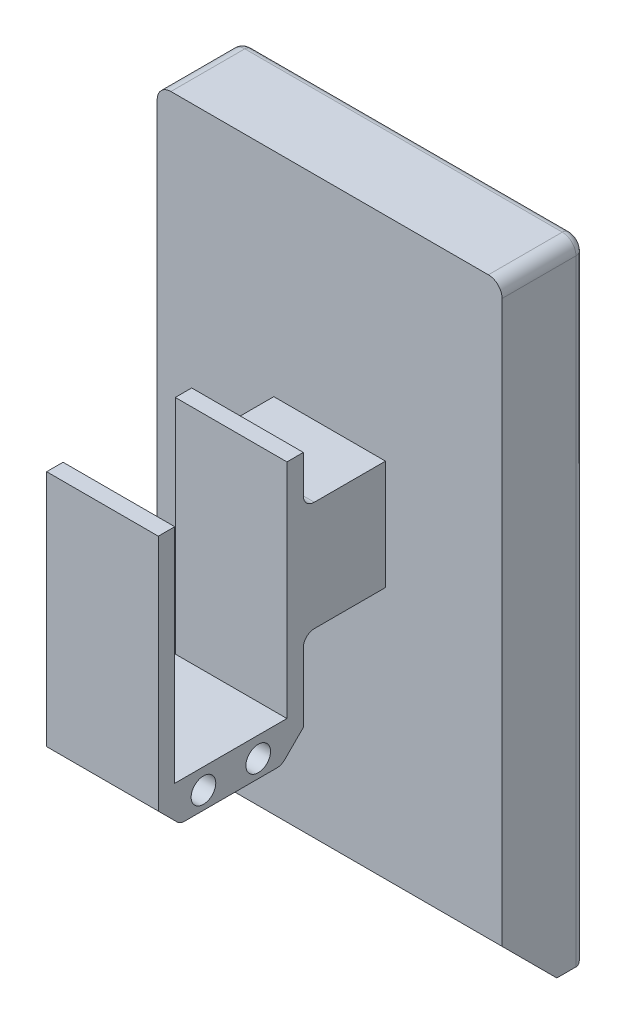
from build123d import *

# Parameters (mm, degrees)
SKETCH1_R            = 2.25
BOSS_EXTRUDE1_DEPTH  = 20
SKETCH2_R            = 2.25
BOSS_EXTRUDE2_DEPTH  = 10
SKETCH4_W            = 26.5
SKETCH4_H            = 2.5
CUT_EXTRUDE1_DEPTH   = 39.17921555
CHAMFER2_SIZE        = 4
CHAMFER3_SIZE        = 4
FILLET4_R            = 2
SKETCH7_W            = 15
SKETCH7_H            = 20
BOSS_EXTRUDE5_DEPTH  = 20
FILLET6_R            = 2
SKETCH13_R           = 2.25
BOSS_EXTRUDE8_DEPTH  = 20
CUT_EXTRUDE2_DEPTH   = 45.021614009
BOSS_EXTRUDE9_START  = -10
SKETCH14_R           = 2.25
BOSS_EXTRUDE9_DEPTH  = 10
BOSS_EXTRUDE10_START = 0.4
SKETCH15_R           = 2.25
BOSS_EXTRUDE10_DEPTH = 0.4
SKETCH16_W           = 63
SKETCH16_H           = 115
BOSS_EXTRUDE11_DEPTH = 15
CHAMFER4_SIZE        = 10
FILLET7_R            = 2.5
FILLET8_R            = 1.5


with BuildPart() as part:
    # Sketch1 → Boss-Extrude1 (new body)
    with BuildSketch(Plane(origin=(0, 0, 0), x_dir=(0, 0, -1), z_dir=(1, 0, 0))):
        Polygon((10.25, -20.3), (13.25, -20.3), (13.25, 29.7), (-13.25, 29.7), (-13.25, -20.3), (-10.25, -20.3), (-10.25, 20.3), (10.25, 20.3), align=None)
        with Locations((5, 24)):
            Circle(SKETCH1_R, mode=Mode.SUBTRACT)
        with Locations((-5, 24)):
            Circle(SKETCH1_R, mode=Mode.SUBTRACT)
    extrude(amount=BOSS_EXTRUDE1_DEPTH)

    # Sketch2 → Boss-Extrude2 (add)
    with BuildSketch(Plane.ZY):
        with Locations((-5, 24)):
            Circle(SKETCH2_R)
        with Locations((5, 24)):
            Circle(SKETCH2_R)
    extrude(amount=-BOSS_EXTRUDE2_DEPTH)

    # Sketch4 → Cut-Extrude1 (cut, through all)
    with BuildSketch(Plane(origin=(20, 0, 0), x_dir=(0, 0, -1), z_dir=(1, 0, 0))):
        with Locations((0, 28.45)):
            Rectangle(SKETCH4_W, SKETCH4_H)
    extrude(amount=-CUT_EXTRUDE1_DEPTH, mode=Mode.SUBTRACT)

    # Chamfer2
    chamfer2_edges = [part.edges().sort_by_distance(p)[0] for p in [
        (10, 27.2, -13.25),
    ]]
    chamfer(chamfer2_edges, length=CHAMFER2_SIZE)

    # Chamfer3
    chamfer3_edges = [part.edges().sort_by_distance(p)[0] for p in [
        (10, 27.2, 13.25),
    ]]
    chamfer(chamfer3_edges, length=CHAMFER3_SIZE)

    # Fillet4
    fillet4_edges = [part.edges().sort_by_distance(p)[0] for p in [
        (10, 27.2, -9.25),
        (10, 27.2, 9.25),
    ]]
    fillet(fillet4_edges, radius=FILLET4_R)

    # Sketch7 → Boss-Extrude5 (add)
    with BuildSketch(Plane(origin=(20, 0, 0), x_dir=(0, 0, -1), z_dir=(1, 0, 0))):
        with Locations((20.75, 1.423218073)):
            Rectangle(SKETCH7_W, SKETCH7_H)
    extrude(amount=-BOSS_EXTRUDE5_DEPTH)

    # Fillet6
    fillet6_edges = [part.edges().sort_by_distance(p)[0] for p in [
        (10, -8.576781927, -13.25),
        (10, 11.423218073, -13.25),
    ]]
    fillet(fillet6_edges, radius=FILLET6_R)

    # Sketch13 → Boss-Extrude8 (add)
    with BuildSketch(Plane(origin=(20, 0, 0), x_dir=(0, 0, -1), z_dir=(1, 0, 0))):
        with BuildLine():
            Line((-13.25, -23.2), (-9.835786438, -26.614213562))
            ThreePointArc((-9.835786438, -26.614213562), (-9.18693974, -27.047759065), (-8.421572875, -27.2))
            Line((-8.421572875, -27.2), (8.421572875, -27.2))
            ThreePointArc((8.421572875, -27.2), (9.18693974, -27.047759065), (9.835786438, -26.614213562))
            Line((9.835786438, -26.614213562), (13.25, -23.2))
            Line((13.25, -23.2), (13.25, -20.3))
            Line((13.25, -20.3), (-13.25, -20.3))
            Line((-13.25, -20.3), (-13.25, -23.2))
        make_face()
        with Locations((5, -24)):
            Circle(SKETCH13_R, mode=Mode.SUBTRACT)
        with Locations((-5, -24)):
            Circle(SKETCH13_R, mode=Mode.SUBTRACT)
    extrude(amount=-BOSS_EXTRUDE8_DEPTH)

    # Sketch12 → Cut-Extrude2 (cut, through all)
    with BuildSketch(Plane(origin=(20, 0, 0), x_dir=(0, 0, -1), z_dir=(1, 0, 0))):
        with BuildLine():
            Line((13.25, 23.2), (9.835786438, 26.614213562))
            ThreePointArc((9.835786438, 26.614213562), (9.18693974, 27.047759065), (8.421572875, 27.2))
            Line((8.421572875, 27.2), (-8.421572875, 27.2))
            ThreePointArc((-8.421572875, 27.2), (-9.18693974, 27.047759065), (-9.835786438, 26.614213562))
            Line((-9.835786438, 26.614213562), (-13.25, 23.2))
            Line((-13.25, 23.2), (-13.25, 20.3))
            Line((-13.25, 20.3), (13.25, 20.3))
            Line((13.25, 20.3), (13.25, 23.2))
        make_face()
    extrude(amount=-CUT_EXTRUDE2_DEPTH, mode=Mode.SUBTRACT)

    # Sketch14 → Boss-Extrude9 (add)
    with BuildSketch(Plane.ZY.offset(BOSS_EXTRUDE9_START)):
        with Locations(Location((-5, -24, 0), (0, 0, 180))):
            Circle(SKETCH14_R)
        with Locations(Location((5, -24, 0), (0, 0, 180))):
            Circle(SKETCH14_R)
    extrude(amount=BOSS_EXTRUDE9_DEPTH)

    # Sketch15 → Boss-Extrude10 (add)
    with BuildSketch(Plane(origin=(20, 0, 0), x_dir=(0, 0, -1), z_dir=(1, 0, 0)).offset(BOSS_EXTRUDE10_START)):
        with BuildLine():
            Line((-10.25, 20.3), (-13.25, 20.3))
            Line((-13.25, 20.3), (-13.25, -23.2))
            Line((-13.25, -23.2), (-9.835786438, -26.614213562))
            ThreePointArc((-9.835786438, -26.614213562), (-9.18693974, -27.047759065), (-8.421572875, -27.2))
            Line((-8.421572875, -27.2), (8.421572875, -27.2))
            ThreePointArc((8.421572875, -27.2), (9.18693974, -27.047759065), (9.835786438, -26.614213562))
            Line((9.835786438, -26.614213562), (13.25, -23.2))
            Line((13.25, -23.2), (13.25, -10.576781927))
            ThreePointArc((13.25, -10.576781927), (13.835786438, -9.162568365), (15.25, -8.576781927))
            Line((15.25, -8.576781927), (28.25, -8.576781927))
            Line((28.25, -8.576781927), (28.25, 11.423218073))
            Line((28.25, 11.423218073), (15.25, 11.423218073))
            ThreePointArc((15.25, 11.423218073), (13.835786438, 12.00900451), (13.25, 13.423218073))
            Line((13.25, 13.423218073), (13.25, 20.3))
            Line((13.25, 20.3), (10.25, 20.3))
            Line((10.25, 20.3), (10.25, -20.3))
            Line((10.25, -20.3), (-10.25, -20.3))
            Line((-10.25, -20.3), (-10.25, 20.3))
        make_face()
        with Locations((5, -24)):
            Circle(SKETCH15_R, mode=Mode.SUBTRACT)
        with Locations((-5, -24)):
            Circle(SKETCH15_R, mode=Mode.SUBTRACT)
    extrude(amount=-BOSS_EXTRUDE10_DEPTH)

    # Sketch16 → Boss-Extrude11 (add)
    with BuildSketch(Plane(origin=(0, 0, -28.25), x_dir=(-1, 0, 0), z_dir=(0, 0, -1))):
        with Locations((-10.2, -7.2)):
            Rectangle(SKETCH16_W, SKETCH16_H)
    extrude(amount=BOSS_EXTRUDE11_DEPTH)

    # Chamfer4
    chamfer4_edges = [part.edges().sort_by_distance(p)[0] for p in [
        (10.2, -64.7, -28.25),
    ]]
    chamfer(chamfer4_edges, length=CHAMFER4_SIZE)

    # Fillet7
    fillet7_edges = [part.edges().sort_by_distance(p)[0] for p in [
        (41.7, 50.3, -35.75),
        (-21.3, 50.3, -35.75),
    ]]
    fillet(fillet7_edges, radius=FILLET7_R)

    # Fillet8
    fillet8_edges = [part.edges().sort_by_distance(p)[0] for p in [
        (10.2, -64.7, -43.25),
        (-21.3, -8.45, -43.25),
        (10.2, 50.3, -43.25),
        (41.7, -8.45, -43.25),
        (40.967766953, 49.567766953, -43.25),
        (-20.567766953, 49.567766953, -43.25),
    ]]
    fillet(fillet8_edges, radius=FILLET8_R)


solid = part.part
